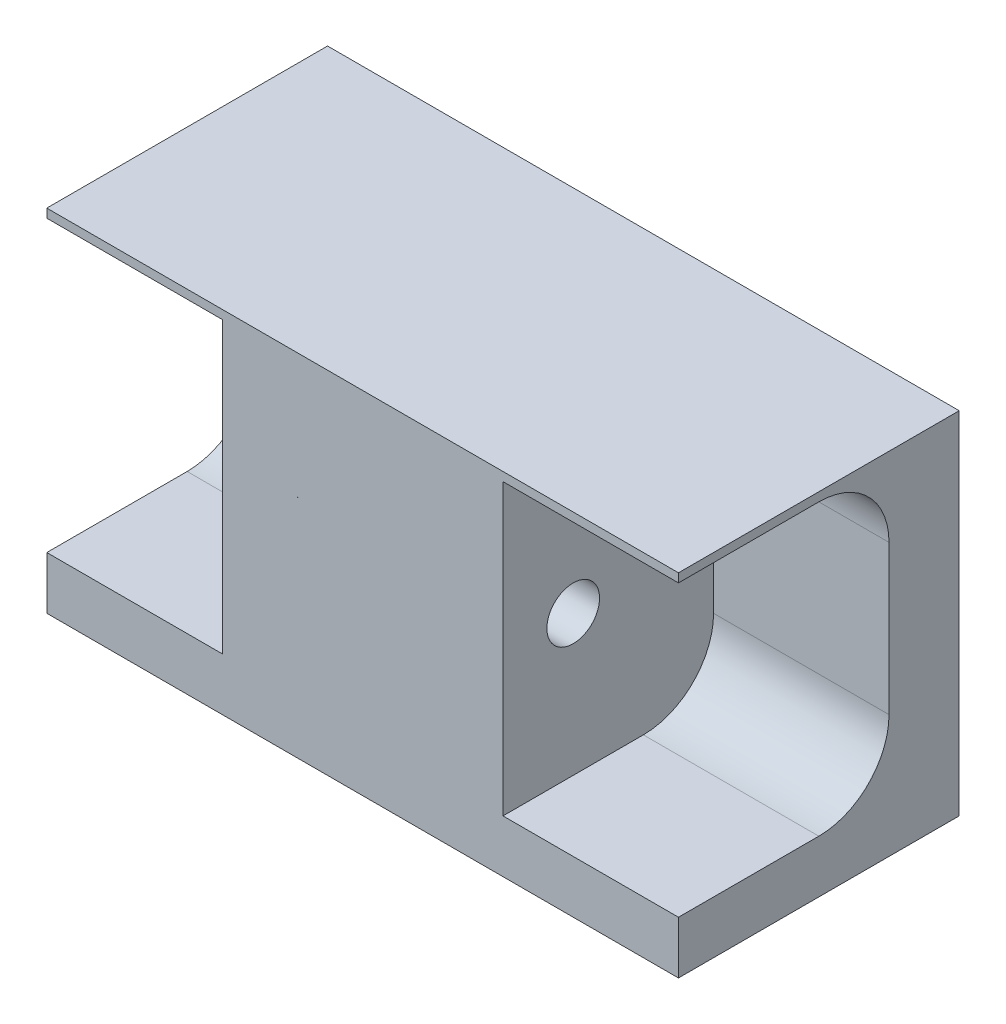
from build123d import *

# Parameters (mm, degrees)
SKETCH1_W           = 203.2
SKETCH1_H           = 254
BOSS_EXTRUDE1_DEPTH = 114.3
CUT_EXTRUDE2_DEPTH  = 127
SKETCH3_R           = 19.05
CUT_EXTRUDE3_DEPTH  = 380.515441056


with BuildPart() as part:
    # Sketch1 → Boss-Extrude1 (new, symmetric)
    with BuildSketch(Plane(origin=(0, 0, 0), x_dir=(0, 0, -1), z_dir=(1, 0, 0))):
        Rectangle(SKETCH1_W, SKETCH1_H)
    extrude(amount=BOSS_EXTRUDE1_DEPTH, both=True)

    # Sketch2 → Cut-Extrude2 (cut)
    with BuildSketch(Plane(origin=(114.3, 0, 0), x_dir=(0, 0, -1), z_dir=(1, 0, 0))):
        with BuildLine():
            Line((-101.6, 120.65), (0, 120.65))
            ThreePointArc((0, 120.65), (35.921024484, 105.771024484), (50.8, 69.85))
            Line((50.8, 69.85), (50.8, -38.1))
            ThreePointArc((50.8, -38.1), (35.921024484, -74.021024484), (0, -88.9))
            Line((0, -88.9), (-101.6, -88.9))
            Line((-101.6, -88.9), (-101.6, 120.65))
        make_face()
    extrude(amount=-CUT_EXTRUDE2_DEPTH, mode=Mode.SUBTRACT)

    # Mirror1: part across plane


with BuildPart() as part_1:
    add(part.part)
    add(part.part.mirror(Plane(origin=(-114.3, 0, 0), x_dir=(0, 0, 1), z_dir=(1, 0, 0))))

    # Sketch3 → Cut-Extrude3 (cut, through all)
    with BuildSketch(Plane(origin=(0, 0, 0), x_dir=(0, 0, -1), z_dir=(1, 0, 0))):
        with Locations((-50.8, 12.7)):
            Circle(SKETCH3_R)
    extrude(amount=-CUT_EXTRUDE3_DEPTH, mode=Mode.SUBTRACT)


solid = part_1.part
